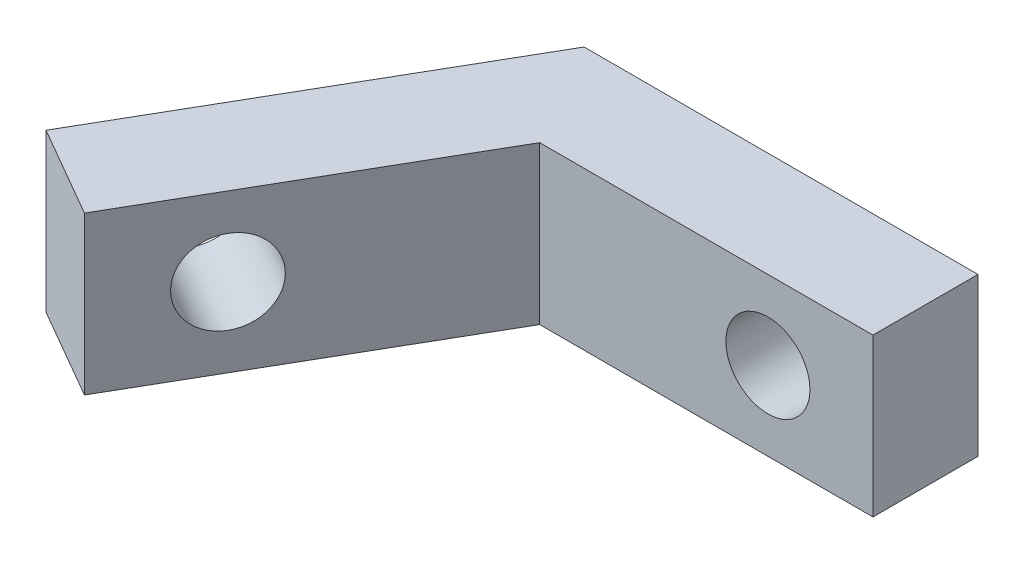
from build123d import *

# Parameters (mm, degrees)
EXTRUDE_1_DEPTH                 = 6
CUT_EXTRUDE_1_REACH             = 24.039
SKETCH_2_R                      = 1.6
CUT_EXTRUDE_1_DIRECTION_2_DEPTH = 23.03886395


with BuildPart() as part:
    # 草图1 → 凸台-拉伸1 (new body)
    with BuildSketch(Plane(origin=(0, 0, 0), x_dir=(1, 0, 0), z_dir=(0, 1, 0))):
        Polygon((0, 0), (15, 0), (15, -4), (2.309401077, -4), (-4.035898385, -14.990381057), (-7.5, -12.990381057), align=None)
    extrude(amount=EXTRUDE_1_DEPTH)

    # 草图2 → 切除-拉伸1 (cut, up to next)
    with BuildSketch(Plane(origin=(0, 0, 0), x_dir=(-0.4999999999999975, 0, 0.86602540378444), z_dir=(-0.86602540378444, 0, -0.4999999999999975)), mode=Mode.PRIVATE) as cut_extrude_1_sk1:
        with Locations(Location((11, 3, 0), (0, 0, 180))):
            Circle(SKETCH_2_R)
    cut_extrude_1_tool1 = extrude(cut_extrude_1_sk1.sketch, amount=-CUT_EXTRUDE_1_REACH, mode=Mode.PRIVATE) & part.part
    cut_extrude_1 = cut_extrude_1_tool1.solids().sort_by_distance((-5.5, 3, 9.526279))[0]
    add(cut_extrude_1, mode=Mode.SUBTRACT)

    # 草图2 → 切除-拉伸1 direction 2 (cut)
    with BuildSketch(Plane(origin=(0, 0, 0), x_dir=(-0.4999999999999975, 0, 0.86602540378444), z_dir=(-0.86602540378444, 0, -0.4999999999999975))):
        with Locations(Location((11, 3, 0), (0, 0, 180))):
            Circle(SKETCH_2_R)
    cut_extrude_1_direction_2 = extrude(amount=CUT_EXTRUDE_1_DIRECTION_2_DEPTH, mode=Mode.SUBTRACT)

    # 镜向1: 切除-拉伸1, 切除-拉伸1 direction 2 across plane
    add(cut_extrude_1.mirror(Plane(origin=(0, 0, 0), x_dir=(0.5000000000000012, 0, 0.8660254037844378), z_dir=(-0.866025403784438, 0, 0.5000000000000012))), mode=Mode.SUBTRACT)
    add(cut_extrude_1_direction_2.mirror(Plane(origin=(0, 0, 0), x_dir=(0.5000000000000012, 0, 0.8660254037844378), z_dir=(-0.866025403784438, 0, 0.5000000000000012))), mode=Mode.SUBTRACT)


solid = part.part
